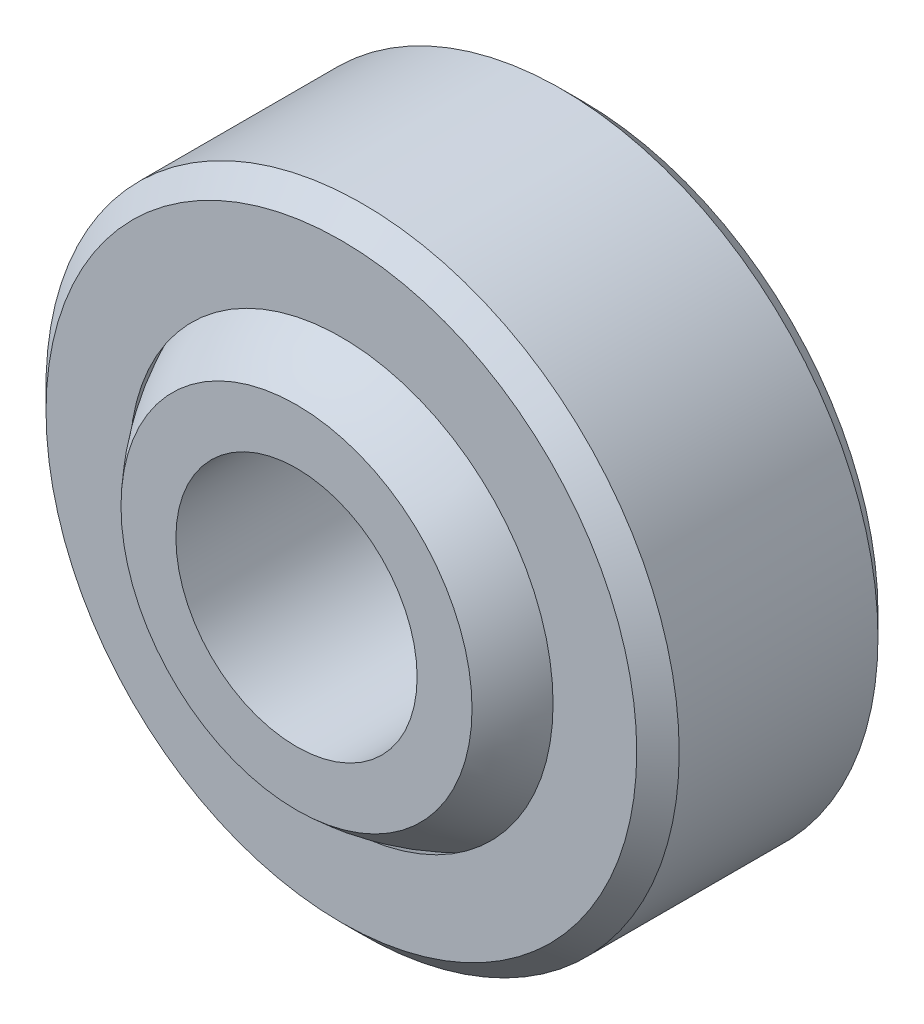
from build123d import *

# Parameters (mm, degrees)
SKETCH1_R               = 8.33374
EXTRUDE1_DEPTH          = 3.175
CUT_EXTRUDE1_DEPTH      = 14.417728087
CUT_EXTRUDE1_DEPTH_BACK = 14.417728087
SKETCH4_R               = 3.175
CUT_EXTRUDE2_DEPTH      = 14.417728087
CUT_EXTRUDE2_DEPTH_BACK = 14.417728087
SKETCH5_W               = 1.143161314
SKETCH5_H               = 16.66748
CHAMFER1_SIZE           = 0.5588


with BuildPart() as part:
    # Sketch1 → Extrude1 (new, symmetric)
    with BuildSketch(Plane.XY):
        Circle(SKETCH1_R)
    extrude(amount=EXTRUDE1_DEPTH, both=True)

    # Sketch2 → Cut-Revolve1 (revolve, cut)
    with BuildSketch(Plane.XY):
        with BuildLine():
            Line((0, 6.4135), (0, -6.4135))
            ThreePointArc((0, -6.4135), (6.4135, 0), (0, 6.4135))
        make_face()
    revolve(axis=Axis((0, 6.4135, 0), (0, 1, 0)), mode=Mode.SUBTRACT)

    # Chamfer1
    chamfer1_edges = [part.edges().sort_by_distance(p)[0] for p in [
        (-8.33374, 0, -3.175),
        (-8.33374, 0, 3.175),
    ]]
    chamfer(chamfer1_edges, length=CHAMFER1_SIZE)


with BuildPart() as body_2:
    # Sketch3 → Revolve1 (revolve)
    with BuildSketch(Plane.XY):
        with BuildLine():
            Line((0, 6.35), (0, -6.35))
            ThreePointArc((0, -6.35), (6.35, 0), (0, 6.35))
        make_face()
    revolve(axis=Axis((0, 6.35, 0), (0, 1, 0)))

    # Sketch4 → Cut-Extrude1 (cut, two sides: drawn at the far end of the back side and taken through both)
    with BuildSketch(Plane.XY.offset(-CUT_EXTRUDE1_DEPTH_BACK)):
        with Locations(Location((0, 0, 0), (0, 0, 180))):
            Circle(SKETCH4_R)
    extrude(amount=CUT_EXTRUDE1_DEPTH + CUT_EXTRUDE1_DEPTH_BACK, mode=Mode.SUBTRACT)

    # Sketch5 → Cut-Extrude2 (cut, two sides: drawn at the far end of the back side and taken through both)
    with BuildSketch(Plane(origin=(0, 0, 0), x_dir=(0, 0, -1), z_dir=(1, 0, 0)).offset(-CUT_EXTRUDE2_DEPTH_BACK)):
        with Locations((-4.927680657, 0)):
            Rectangle(SKETCH5_W, SKETCH5_H)
        with Locations((4.927680657, 0)):
            Rectangle(SKETCH5_W, SKETCH5_H)
    extrude(amount=CUT_EXTRUDE2_DEPTH + CUT_EXTRUDE2_DEPTH_BACK, mode=Mode.SUBTRACT)


solid = Compound([part.part, body_2.part])
